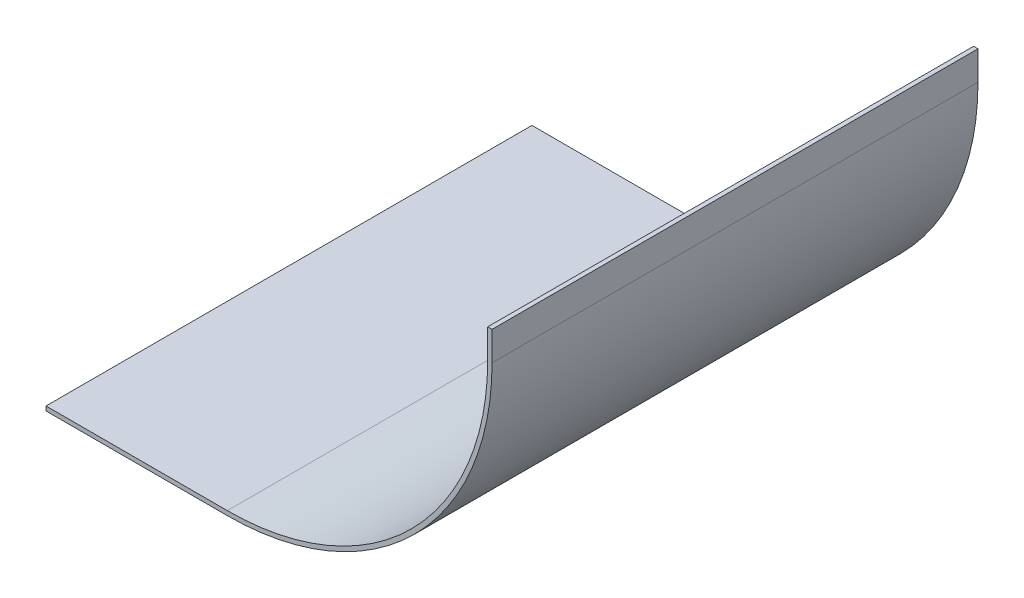
from build123d import *

# Parameters (mm, degrees)
EXTRUDE_THIN1_DEPTH = 670


with BuildPart() as part:
    # Sketch1 → Extrude-Thin1 (new body)
    with BuildSketch(Plane.XY):
        with BuildLine():
            Line((1565, -4410), (1565, -4450))
            ThreePointArc((1565, -4450), (1458.093975133, -4708.093975133), (1200, -4815))
            Line((1200, -4815), (950, -4815))
            Line((950, -4815), (950, -4809))
            Line((950, -4809), (1200, -4809))
            ThreePointArc((1200, -4809), (1453.851334446, -4703.851334446), (1559, -4450))
            Line((1559, -4450), (1559, -4410))
            Line((1559, -4410), (1565, -4410))
        make_face()
    extrude(amount=-EXTRUDE_THIN1_DEPTH)


solid = part.part
